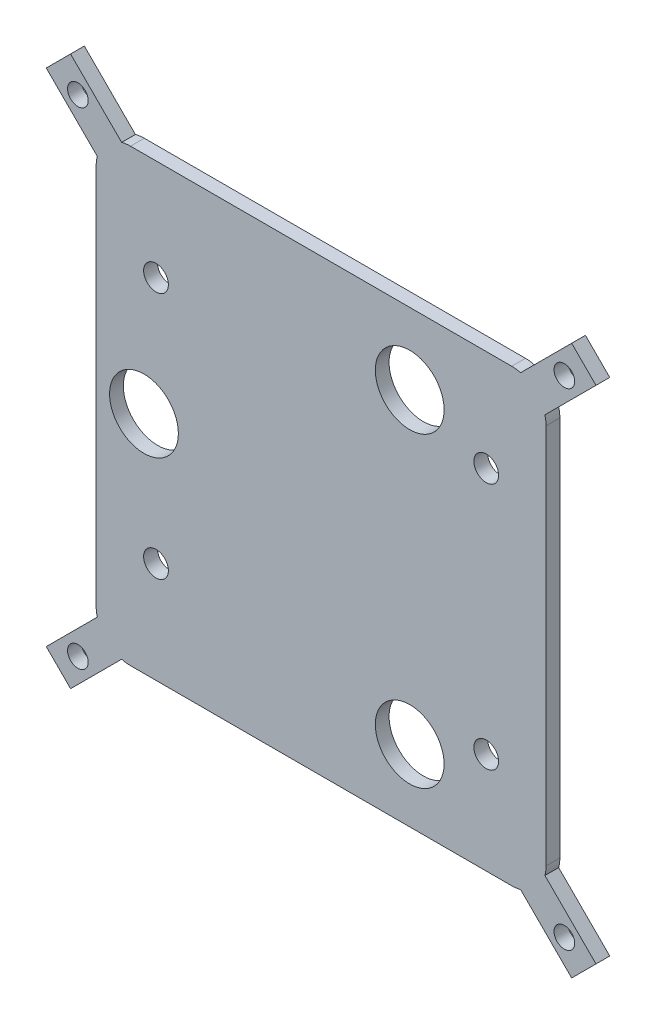
from build123d import *

# Parameters (mm, degrees)
SKETCH_1_R          = 1.8
EXTRUDE_1_DEPTH     = 2
EXTRUDE_START       = -2
EXTRUDE_2_DEPTH     = 2
CUT_EXTRUDE_1_REACH = 58.535
SKETCH_4_R          = 1.5
CUT_EXTRUDE_2_REACH = 58.535
SKETCH_5_R          = 5


with BuildPart() as part:
    # 草图1 → 凸台-拉伸1 (new body)
    with BuildSketch(Plane.XY):
        with BuildLine():
            Line((-27.7, -32.7), (27.7, -32.7))
            ThreePointArc((27.7, -32.7), (31.235533906, -31.235533906), (32.7, -27.7))
            Line((32.7, -27.7), (32.7, 27.7))
            ThreePointArc((32.7, 27.7), (31.235533906, 31.235533906), (27.7, 32.7))
            Line((27.7, 32.7), (-27.7, 32.7))
            ThreePointArc((-27.7, 32.7), (-31.235533906, 31.235533906), (-32.7, 27.7))
            Line((-32.7, 27.7), (-32.7, -27.7))
            ThreePointArc((-32.7, -27.7), (-31.235533906, -31.235533906), (-27.7, -32.7))
        make_face()
        with Locations((24, 18)):
            Circle(SKETCH_1_R, mode=Mode.SUBTRACT)
        with Locations((-24, 18)):
            Circle(SKETCH_1_R, mode=Mode.SUBTRACT)
        with Locations((-24, -18)):
            Circle(SKETCH_1_R, mode=Mode.SUBTRACT)
        with Locations((24, -18)):
            Circle(SKETCH_1_R, mode=Mode.SUBTRACT)
    extrude(amount=EXTRUDE_1_DEPTH)

    # 草图3 → 凸台-拉伸2 (add)
    with BuildSketch(Plane.XY.offset(2).offset(EXTRUDE_START)):
        with BuildLine():
            Line((-39.951533137, 36.415999231), (-33.003300859, 29.467766953))
            Line((-33.003300859, 29.467766953), (-32.529629131, 28.994095226))
            ThreePointArc((-32.529629131, 28.994095226), (-31.235533906, 31.235533906), (-28.994095226, 32.529629131))
            Line((-28.994095226, 32.529629131), (-29.467766953, 33.003300859))
            Line((-29.467766953, 33.003300859), (-36.415999231, 39.951533137))
            Line((-36.415999231, 39.951533137), (-39.951533137, 36.415999231))
        make_face()
        with BuildLine():
            ThreePointArc((-28.994095226, 32.529629131), (-31.235533906, 31.235533906), (-32.529629131, 28.994095226))
            Line((-32.529629131, 28.994095226), (-31.037342597, 27.501808691))
            Line((-31.037342597, 27.501808691), (-27.501808691, 31.037342597))
            Line((-27.501808691, 31.037342597), (-28.994095226, 32.529629131))
        make_face()
        with BuildLine():
            ThreePointArc((32.529629131, 28.994095226), (31.235533906, 31.235533906), (28.994095226, 32.529629131))
            Line((28.994095226, 32.529629131), (27.501808691, 31.037342597))
            Line((27.501808691, 31.037342597), (31.037342597, 27.501808691))
            Line((31.037342597, 27.501808691), (32.529629131, 28.994095226))
        make_face()
        with BuildLine():
            Line((29.467766953, 33.003300859), (28.994095226, 32.529629131))
            ThreePointArc((28.994095226, 32.529629131), (31.235533906, 31.235533906), (32.529629131, 28.994095226))
            Line((32.529629131, 28.994095226), (33.003300859, 29.467766953))
            Line((33.003300859, 29.467766953), (39.951533137, 36.415999231))
            Line((39.951533137, 36.415999231), (36.415999231, 39.951533137))
            Line((36.415999231, 39.951533137), (29.467766953, 33.003300859))
        make_face()
        with BuildLine():
            Line((27.501808691, -31.037342597), (28.994095226, -32.529629131))
            ThreePointArc((28.994095226, -32.529629131), (31.235533906, -31.235533906), (32.529629131, -28.994095226))
            Line((32.529629131, -28.994095226), (31.037342597, -27.501808691))
            Line((31.037342597, -27.501808691), (27.501808691, -31.037342597))
        make_face()
        with BuildLine():
            ThreePointArc((32.529629131, -28.994095226), (31.235533906, -31.235533906), (28.994095226, -32.529629131))
            Line((28.994095226, -32.529629131), (29.467766953, -33.003300859))
            Line((29.467766953, -33.003300859), (36.415999231, -39.951533137))
            Line((36.415999231, -39.951533137), (39.951533137, -36.415999231))
            Line((39.951533137, -36.415999231), (33.003300859, -29.467766953))
            Line((33.003300859, -29.467766953), (32.529629131, -28.994095226))
        make_face()
        with BuildLine():
            ThreePointArc((-28.994095226, -32.529629131), (-31.235533906, -31.235533906), (-32.529629131, -28.994095226))
            Line((-32.529629131, -28.994095226), (-33.003300859, -29.467766953))
            Line((-33.003300859, -29.467766953), (-39.951533137, -36.415999231))
            Line((-39.951533137, -36.415999231), (-36.415999231, -39.951533137))
            Line((-36.415999231, -39.951533137), (-29.467766953, -33.003300859))
            Line((-29.467766953, -33.003300859), (-28.994095226, -32.529629131))
        make_face()
        with BuildLine():
            Line((-31.037342597, -27.501808691), (-32.529629131, -28.994095226))
            ThreePointArc((-32.529629131, -28.994095226), (-31.235533906, -31.235533906), (-28.994095226, -32.529629131))
            Line((-28.994095226, -32.529629131), (-27.501808691, -31.037342597))
            Line((-27.501808691, -31.037342597), (-31.037342597, -27.501808691))
        make_face()
    extrude(amount=EXTRUDE_2_DEPTH)

    # 草图4 → 切除-拉伸1 (cut, up to next)
    with BuildSketch(Plane.XY.offset(2), mode=Mode.PRIVATE) as cut_extrude_1_sk1:
        with Locations((-35.355339059, 35.355339059)):
            Circle(SKETCH_4_R)
    cut_extrude_1_tool1 = extrude(cut_extrude_1_sk1.sketch, amount=-CUT_EXTRUDE_1_REACH, mode=Mode.PRIVATE) & part.part
    # 草图4 → 切除-拉伸1 (cut, up to next)
    with BuildSketch(Plane.XY.offset(2), mode=Mode.PRIVATE) as cut_extrude_1_sk2:
        with Locations((35.355339059, 35.355339059)):
            Circle(SKETCH_4_R)
    cut_extrude_1_tool2 = extrude(cut_extrude_1_sk2.sketch, amount=-CUT_EXTRUDE_1_REACH, mode=Mode.PRIVATE) & part.part
    # 草图4 → 切除-拉伸1 (cut, up to next)
    with BuildSketch(Plane.XY.offset(2), mode=Mode.PRIVATE) as cut_extrude_1_sk3:
        with Locations((35.355339059, -35.355339059)):
            Circle(SKETCH_4_R)
    cut_extrude_1_tool3 = extrude(cut_extrude_1_sk3.sketch, amount=-CUT_EXTRUDE_1_REACH, mode=Mode.PRIVATE) & part.part
    # 草图4 → 切除-拉伸1 (cut, up to next)
    with BuildSketch(Plane.XY.offset(2), mode=Mode.PRIVATE) as cut_extrude_1_sk4:
        with Locations((-35.355339059, -35.355339059)):
            Circle(SKETCH_4_R)
    cut_extrude_1_tool4 = extrude(cut_extrude_1_sk4.sketch, amount=-CUT_EXTRUDE_1_REACH, mode=Mode.PRIVATE) & part.part
    add(cut_extrude_1_tool1.solids().sort_by_distance((-35.355339, 35.355339, 2))[0], mode=Mode.SUBTRACT)
    add(cut_extrude_1_tool2.solids().sort_by_distance((35.355339, 35.355339, 2))[0], mode=Mode.SUBTRACT)
    add(cut_extrude_1_tool3.solids().sort_by_distance((35.355339, -35.355339, 2))[0], mode=Mode.SUBTRACT)
    add(cut_extrude_1_tool4.solids().sort_by_distance((-35.355339, -35.355339, 2))[0], mode=Mode.SUBTRACT)

    # 草图5 → 切除-拉伸2 (cut, up to next)
    with BuildSketch(Plane.XY.offset(2), mode=Mode.PRIVATE) as cut_extrude_2_sk1:
        with Locations((-25.75, 0)):
            Circle(SKETCH_5_R)
    cut_extrude_2_tool1 = extrude(cut_extrude_2_sk1.sketch, amount=-CUT_EXTRUDE_2_REACH, mode=Mode.PRIVATE) & part.part
    # 草图5 → 切除-拉伸2 (cut, up to next)
    with BuildSketch(Plane.XY.offset(2), mode=Mode.PRIVATE) as cut_extrude_2_sk2:
        with Locations((12.875, 22.300154147)):
            Circle(SKETCH_5_R)
    cut_extrude_2_tool2 = extrude(cut_extrude_2_sk2.sketch, amount=-CUT_EXTRUDE_2_REACH, mode=Mode.PRIVATE) & part.part
    # 草图5 → 切除-拉伸2 (cut, up to next)
    with BuildSketch(Plane.XY.offset(2), mode=Mode.PRIVATE) as cut_extrude_2_sk3:
        with Locations((12.875, -22.300154147)):
            Circle(SKETCH_5_R)
    cut_extrude_2_tool3 = extrude(cut_extrude_2_sk3.sketch, amount=-CUT_EXTRUDE_2_REACH, mode=Mode.PRIVATE) & part.part
    add(cut_extrude_2_tool1.solids().sort_by_distance((-25.75, 0, 2))[0], mode=Mode.SUBTRACT)
    add(cut_extrude_2_tool2.solids().sort_by_distance((12.875, 22.300154, 2))[0], mode=Mode.SUBTRACT)
    add(cut_extrude_2_tool3.solids().sort_by_distance((12.875, -22.300154, 2))[0], mode=Mode.SUBTRACT)


solid = part.part
